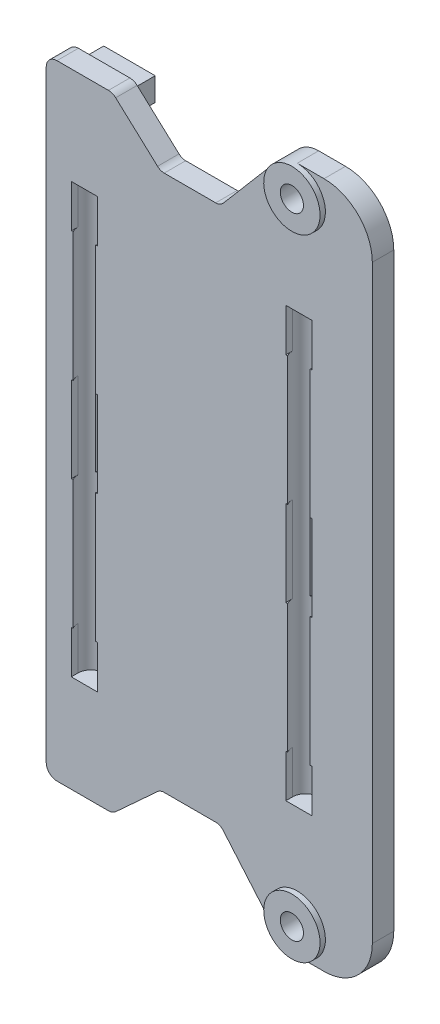
from build123d import *

# Parameters (mm, degrees)
SKETCH3_R           = 1.373
DOWEL_BODIES_DEPTH  = 13
BOSS_EXTRUDE3_DEPTH = 2.54
SKETCH5_W           = 6.096
SKETCH5_H           = 2.746000096
BOSS_EXTRUDE4_DEPTH = 3
SKETCH6_R           = 3.33375
SKETCH6_R_2         = 1.373
BOSS_EXTRUDE7_DEPTH = 0.635
SKETCH8_R           = 1.55
CUT_EXTRUDE1_DEPTH  = 25.4
CUT_EXTRUDE2_REACH  = 199.349
SKETCH9_W           = 1.5875
SKETCH9_H           = 10.16
CUT_EXTRUDE3_START  = -0.788
SKETCH10_W          = 3.1
SKETCH10_H          = 5.08
SKETCH10_H_2        = 10.16
CUT_EXTRUDE3_DEPTH  = 0.788
LPATTERN1_COUNT     = 2
LPATTERN1_PITCH     = 25.4


with BuildPart() as part:
    # Sketch3 → Dowel Bodies (new body)
    with BuildSketch(Plane.XY):
        with Locations(Location((184.15, 37.30625, 0), (0, 0, 180))):
            Circle(SKETCH3_R)
    extrude(amount=DOWEL_BODIES_DEPTH)


with BuildPart() as body_2:
    # Sketch4 → Boss-Extrude3 (new body)
    with BuildSketch(Plane.XY):
        with BuildLine():
            Line((168.402, 31.75), (174.498, 31.75))
            ThreePointArc((174.498, 31.75), (174.987232511, 31.857499863), (175.386332323, 32.160194447))
            Line((175.386332323, 32.160194447), (181.612315337, 39.468204119))
            ThreePointArc((181.612315337, 39.468204119), (182.752417351, 40.332906869), (184.15, 40.64))
            Line((184.15, 40.64), (187.325, 40.64))
            ThreePointArc((187.325, 40.64), (191.366115254, 38.966115254), (193.04, 34.925))
            Line((193.04, 34.925), (193.04, 0))
            Line((193.04, 0), (154.432, 0))
            Line((154.432, 0), (154.432, 35.663000048))
            ThreePointArc((154.432, 35.663000048), (154.803974388, 36.56102566), (155.702, 36.933000048))
            Line((155.702, 36.933000048), (161.798, 36.933000048))
            ThreePointArc((161.798, 36.933000048), (162.258293304, 36.846651211), (162.655994809, 36.599346622))
            Line((162.655994809, 36.599346622), (167.613590629, 32.056593332))
            ThreePointArc((167.613590629, 32.056593332), (167.979037588, 31.829345739), (168.402, 31.75))
        make_face()
    extrude(amount=BOSS_EXTRUDE3_DEPTH)

    # Combine1: cut part
    add(part.part, mode=Mode.SUBTRACT)

    # Sketch5 → Boss-Extrude4 (add)
    with BuildSketch(Plane(origin=(0, 0, 0), x_dir=(-1, 0, 0), z_dir=(0, 0, -1))):
        with Locations((-184.15, 34.29)):
            Rectangle(SKETCH5_W, SKETCH5_H)
        with Locations((-158.75, 34.29)):
            Rectangle(SKETCH5_W, SKETCH5_H)
    extrude(amount=BOSS_EXTRUDE4_DEPTH)

    # Sketch6 → Boss-Extrude7 (add)
    with BuildSketch(Plane.XY.offset(2.54)):
        with Locations(Location((184.15, 37.30625, 0), (0, 0, 139.571007131))):
            Circle(SKETCH6_R)
        with Locations(Location((184.15, 37.30625, 0), (0, 0, 180))):
            Circle(SKETCH6_R_2, mode=Mode.SUBTRACT)
    extrude(amount=BOSS_EXTRUDE7_DEPTH)

    # Mirror3: body 2 across plane


with BuildPart() as body_2_1:
    add(body_2.part)
    add(body_2.part.mirror(Plane.ZX))

    # Sketch8 → Cut-Extrude1 (cut, symmetric)
    with BuildSketch(Plane(origin=(0, 0, 0), x_dir=(1, 0, 0), z_dir=(0, 1, 0))):
        with Locations((158.951107585, -1.752)):
            Circle(SKETCH8_R)
    cut_extrude1 = extrude(amount=CUT_EXTRUDE1_DEPTH, both=True, mode=Mode.SUBTRACT)

    # Sketch9 → Cut-Extrude2 (cut, up to next)
    with BuildSketch(Plane.XY.offset(2.54), mode=Mode.PRIVATE) as cut_extrude2_sk1:
        with Locations((158.951107585, 0)):
            Rectangle(SKETCH9_W, SKETCH9_H)
    cut_extrude2_tool1 = extrude(cut_extrude2_sk1.sketch, amount=-CUT_EXTRUDE2_REACH, mode=Mode.PRIVATE) & body_2_1.part
    cut_extrude2 = cut_extrude2_tool1.solids().sort_by_distance((158.951108, 0, 2.54))[0]
    add(cut_extrude2, mode=Mode.SUBTRACT)

    # Sketch10 → Cut-Extrude3 (cut)
    with BuildSketch(Plane.XY.offset(2.54).offset(CUT_EXTRUDE3_START)):
        with Locations((158.951107585, 22.86)):
            Rectangle(SKETCH10_W, SKETCH10_H)
        with Locations((158.951107585, 0)):
            Rectangle(SKETCH10_W, SKETCH10_H_2)
        with Locations((158.951107585, -22.86)):
            Rectangle(SKETCH10_W, SKETCH10_H)
    cut_extrude3 = extrude(amount=CUT_EXTRUDE3_DEPTH, mode=Mode.SUBTRACT)

    # LPattern1: Cut-Extrude1, Cut-Extrude2, Cut-Extrude3 ×2
    with Locations(*[(i * LPATTERN1_PITCH, 0, 0) for i in range(1, LPATTERN1_COUNT)]):
        add(cut_extrude1, mode=Mode.SUBTRACT)
        add(cut_extrude2, mode=Mode.SUBTRACT)
        add(cut_extrude3, mode=Mode.SUBTRACT)


solid = body_2_1.part
